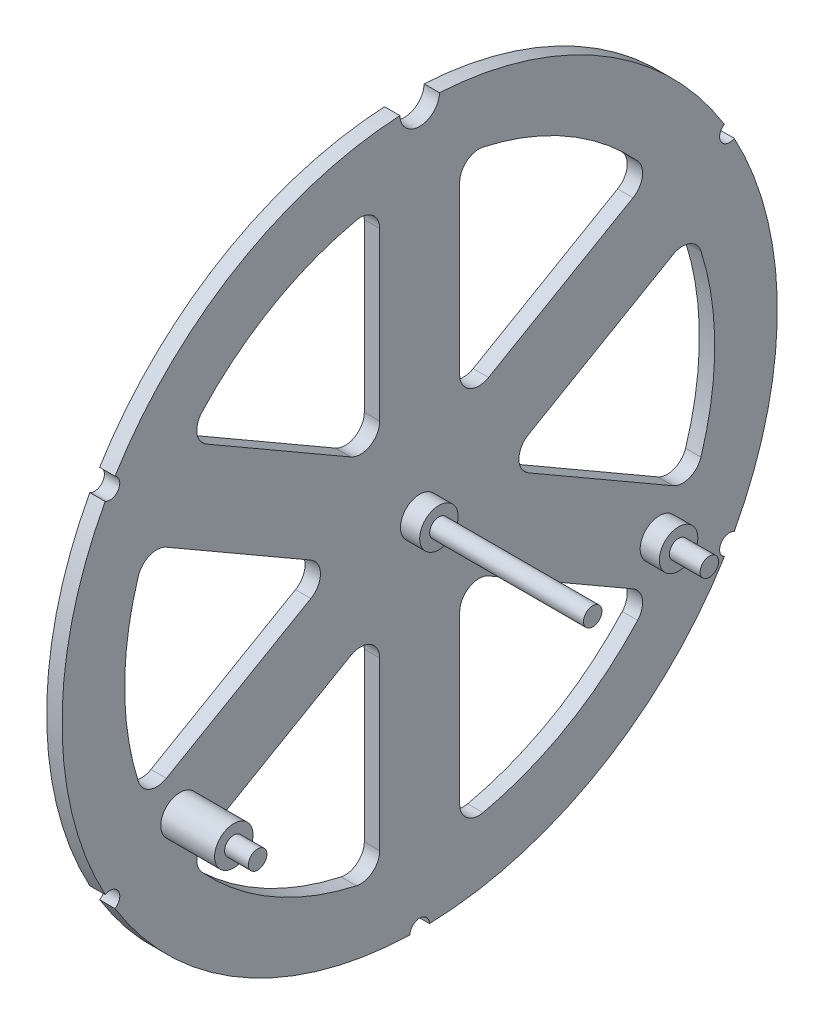
from build123d import *

# Parameters (mm, degrees)
SKETCH_1_R               = 93.03002178900209
EXTRUDE_1_DEPTH          = 4
SKETCH_2_R               = 2.4
EXTRUDE_2_DEPTH          = 45
SKETCH_3_R               = 5
EXTRUDE_3_DEPTH          = 5
SKETCH_4_R               = 2.3999999999999937
EXTRUDE_4_DEPTH          = 12.999999999999998
SKETCH_5_R               = 4.9999999999999964
EXTRUDE_5_DEPTH          = 4.999999999999997
SKETCH_6_R               = 2.3999999999999932
EXTRUDE_6_DEPTH          = 20.200000000000017
SKETCH_7_R               = 4.9999999999999964
EXTRUDE_7_DEPTH          = 14
CUT_EXTRUDE_1_REACH      = 141.047
SKETCH_8_R               = 5.153202095824808
SKETCH_9_R               = 2.5515156643505628
SKETCH_9_R_2             = 2.551515664350585
SKETCH_9_R_3             = 2.551515664350554
SKETCH_9_R_4             = 2.5515156643508896
CUT_EXTRUDE_3_DEPTH      = 5.9999999999999964
CUT_EXTRUDE_4_REACH      = 141.024
PATTERN_CIRCULAR_1_COUNT = 6
FILLET_1_R               = 5


with BuildPart() as part:
    # 草图1 → 凸台-拉伸1 (new body)
    with BuildSketch(Plane(origin=(0, 0, 0), x_dir=(0, 0, -1), z_dir=(1, 0, 0))):
        Circle(SKETCH_1_R)
    extrude(amount=EXTRUDE_1_DEPTH)

    # 草图2 → 凸台-拉伸2 (add)
    with BuildSketch(Plane(origin=(4, 0, 0), x_dir=(0, 0, -1), z_dir=(1, 0, 0))):
        with Locations(Location((0, 0, 0), (0, 0, 180))):
            Circle(SKETCH_2_R)
    extrude(amount=EXTRUDE_2_DEPTH)

    # 草图3 → 凸台-拉伸3 (add)
    with BuildSketch(Plane(origin=(4, 0, 0), x_dir=(0, 0, -1), z_dir=(1, 0, 0))):
        Circle(SKETCH_3_R)
    extrude(amount=EXTRUDE_3_DEPTH)

    # 草图4 → 凸台-拉伸4 (add)
    with BuildSketch(Plane(origin=(4, 0, 0), x_dir=(0, 0, -1), z_dir=(1, 0, 0))):
        with Locations((62.35382907247964, -35.9999999999998)):
            Circle(SKETCH_4_R)
    extrude(amount=EXTRUDE_4_DEPTH)

    # 草图5 → 凸台-拉伸5 (add)
    with BuildSketch(Plane(origin=(4, 0, 0), x_dir=(0, 0, -1), z_dir=(1, 0, 0))):
        with Locations((62.35382907247964, -35.9999999999998)):
            Circle(SKETCH_5_R)
    extrude(amount=EXTRUDE_5_DEPTH)

    # 草图6 → 凸台-拉伸6 (add)
    with BuildSketch(Plane(origin=(4, 0, 0), x_dir=(0, 0, -1), z_dir=(1, 0, 0))):
        with Locations((-62.35382907247939, -36.00000000000031)):
            Circle(SKETCH_6_R)
    extrude(amount=EXTRUDE_6_DEPTH)

    # 草图7 → 凸台-拉伸7 (add)
    with BuildSketch(Plane(origin=(4, 0, 0), x_dir=(0, 0, -1), z_dir=(1, 0, 0))):
        with Locations((-62.35382907247939, -36.00000000000031)):
            Circle(SKETCH_7_R)
    extrude(amount=EXTRUDE_7_DEPTH)

    # 草图8 → 切除-拉伸1 (cut, up to next)
    with BuildSketch(Plane(origin=(4, 0, 0), x_dir=(0, 0, -1), z_dir=(1, 0, 0)), mode=Mode.PRIVATE) as cut_extrude_1_sk1:
        with Locations((0, 93.03002178900209)):
            Circle(SKETCH_8_R)
    cut_extrude_1_tool1 = extrude(cut_extrude_1_sk1.sketch, amount=-CUT_EXTRUDE_1_REACH, mode=Mode.PRIVATE) & part.part
    add(cut_extrude_1_tool1.solids().sort_by_distance((4, 93.030022, 0))[0], mode=Mode.SUBTRACT)

    # 草图9 → 切除-拉伸3 (cut)
    with BuildSketch(Plane(origin=(4, 0, 0), x_dir=(0, 0, -1), z_dir=(1, 0, 0))):
        with Locations((3.47e-15, 93.03002178900209)):
            Circle(SKETCH_9_R)
        with Locations((80.56636218389566, 46.515010894501074)):
            Circle(SKETCH_9_R_2)
        with Locations((80.56636218389568, -46.51501089450103)):
            Circle(SKETCH_9_R_3)
        with Locations((8.67e-15, -93.03002178900209)):
            Circle(SKETCH_9_R)
        with Locations((-80.56636218389565, -46.51501089450109)):
            Circle(SKETCH_9_R_3)
        with Locations((-80.56636218389569, 46.51501089450098)):
            Circle(SKETCH_9_R_4)
    extrude(amount=-CUT_EXTRUDE_3_DEPTH, mode=Mode.SUBTRACT)

    # 草图10 → 切除-拉伸4 (cut, up to next)
    with BuildSketch(Plane(origin=(4, 0, 0), x_dir=(0, 0, -1), z_dir=(1, 0, 0)), mode=Mode.PRIVATE) as cut_extrude_4_sk1:
        with BuildLine():
            Line((-10.407514658464736, 18.02634416897966), (-10.407514658464395, 76.04625246317465))
            ThreePointArc((-10.407514658464395, 76.04625246317465), (-38.37756139679427, 66.47188620984315), (-60.65422916648111, 47.03629831607756))
            Line((-60.65422916648111, 47.03629831607756), (-10.407514658464736, 18.02634416897966))
        make_face()
    cut_extrude_4_tool1 = extrude(cut_extrude_4_sk1.sketch, amount=-CUT_EXTRUDE_4_REACH, mode=Mode.PRIVATE) & part.part
    cut_extrude_4 = cut_extrude_4_tool1.solids().sort_by_distance((4, 49.214145, 28.4138))[0]
    add(cut_extrude_4, mode=Mode.SUBTRACT)

    # 阵列(圆周)1: 切除-拉伸4 ×6 about axis
    pattern_circular_1_axis = Axis((0, -1e-16, -8.9e-16), (1, 0, 0))
    for i in range(1, PATTERN_CIRCULAR_1_COUNT):
        add(cut_extrude_4.rotate(pattern_circular_1_axis, i * 360 / PATTERN_CIRCULAR_1_COUNT), mode=Mode.SUBTRACT)

    # 圆角1
    fillet_1_edges = [part.edges().sort_by_distance(p)[0] for p in [
        (2, 18.02634416897966, 10.407514658464736),
        (2, 47.03629831607757, 60.65422916648111),
        (2, 76.04625246317465, 10.407514658464397),
        (2, -18.026344168979215, 10.407514658465503),
        (2, -76.04625246317445, 10.407514658465852),
        (2, -47.036298316076405, 60.654229166482004),
        (2, 4.4326e-13, 20.815029316930236),
        (2, -29.009954147096884, 71.06174382494694),
        (2, 29.00995414709824, 71.06174382494639),
        (2, -4.5413e-13, -20.815029316930236),
        (2, 29.009954147096852, -71.06174382494696),
        (2, -29.00995414709827, -71.06174382494638),
        (2, -18.02634416897966, -10.407514658464736),
        (2, -47.03629831607758, -60.6542291664811),
        (2, -76.04625246317465, -10.40751465846439),
        (2, 18.026344168979218, -10.4075146584655),
        (2, 76.04625246317445, -10.407514658465825),
        (2, 47.036298316076426, -60.65422916648199),
    ]]
    fillet(fillet_1_edges, radius=FILLET_1_R)


solid = part.part
